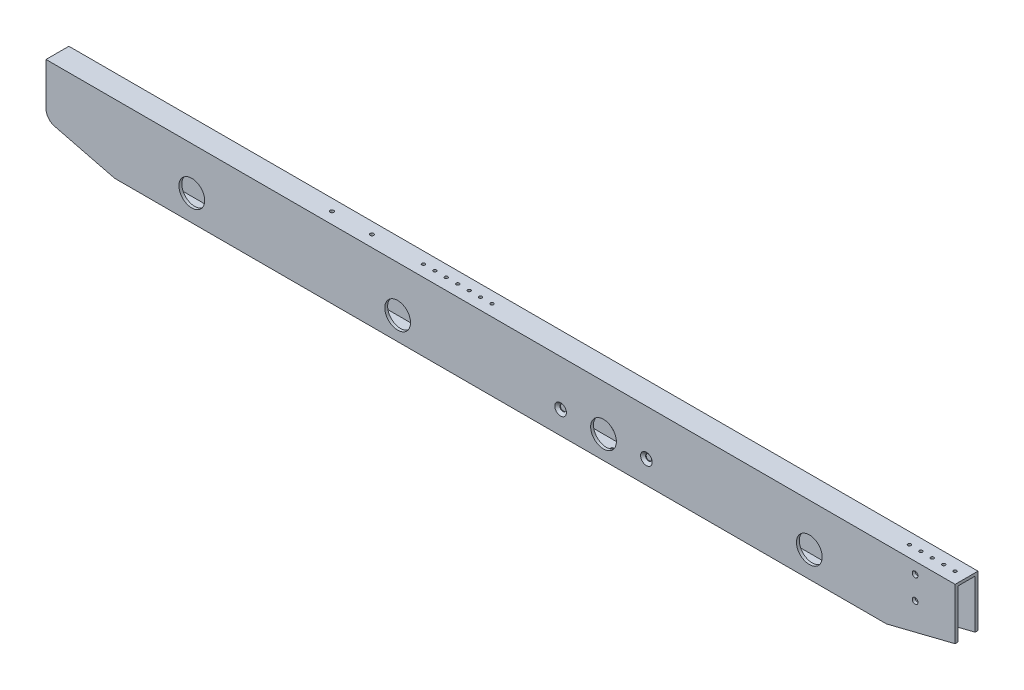
from build123d import *

# Parameters (mm, degrees)
SKETCH1_W                                           = 1009.65
SKETCH1_H                                           = 76.2
SKETCH1_R                                           = 14.2875
BOSS_EXTRUDE2_DEPTH                                 = 12.7
SKETCH3_W                                           = 19.05
SKETCH3_H                                           = 69.85
CUT_EXTRUDE2_DEPTH                                  = 1011.448426442
CUT_EXTRUDE3_DEPTH                                  = 507.897475457
FILLET1_R                                           = 12.7
SKETCH9_R                                           = 1.7272
CUT_EXTRUDE4_DEPTH                                  = 2.54
SKETCH12_R                                          = 1.7272
CUT_EXTRUDE7_DEPTH                                  = 5.08
CSK_FOR_1_4_FLAT_HEAD_MACHINE_SCREW_100_D           = 6.7564
CSK_FOR_1_4_FLAT_HEAD_MACHINE_SCREW_100_CSINK_D     = 12.8778
CSK_FOR_1_4_FLAT_HEAD_MACHINE_SCREW_100_CSINK_ANGLE = 100
CUT_EXTRUDE8_START                                  = -6.35
SKETCH17_R                                          = 1.7272
CUT_EXTRUDE8_DEPTH                                  = 6.35
SKETCH18_R                                          = 17.4625
CUT_EXTRUDE9_DEPTH                                  = 3.81
F_1_4_0_25_DIAMETER_HOLE1_D                         = 6.35
F_10_32_TAPPED_HOLE1_D                              = 4.0386
F_10_32_TAPPED_HOLE1_DEPTH                          = 13.716
F_10_32_TAPPED_HOLE1_TIP                            = 1.213317848


with BuildPart() as part:
    # Sketch1 → Boss-Extrude2 (new, symmetric)
    with BuildSketch(Plane.XY):
        Rectangle(SKETCH1_W, SKETCH1_H)
        with Locations((-114.3, -12.7)):
            Circle(SKETCH1_R, mode=Mode.SUBTRACT)
        with Locations((114.3, -12.7)):
            Circle(SKETCH1_R, mode=Mode.SUBTRACT)
        with Locations((-342.9, -9.525)):
            Circle(SKETCH1_R, mode=Mode.SUBTRACT)
        with Locations((342.9, -9.525)):
            Circle(SKETCH1_R, mode=Mode.SUBTRACT)
    extrude(amount=BOSS_EXTRUDE2_DEPTH, both=True)

    # Sketch3 → Cut-Extrude2 (cut, through all)
    with BuildSketch(Plane(origin=(504.825, 0, 0), x_dir=(0, 0, -1), z_dir=(1, 0, 0))):
        Rectangle(SKETCH3_W, SKETCH3_H)
    extrude(amount=-CUT_EXTRUDE2_DEPTH, mode=Mode.SUBTRACT)

    # Sketch4 → Cut-Extrude3 (cut, through all)
    with BuildSketch(Plane.XY.offset(12.7)):
        Polygon((-504.825, -38.1), (-504.825, -19.05), (-428.625, -38.1), align=None)
        Polygon((428.625, -38.1), (504.825, -38.1), (504.825, -19.05), align=None)
    extrude(amount=-CUT_EXTRUDE3_DEPTH, mode=Mode.SUBTRACT)

    # Fillet1
    fillet1_edges = [part.edges().sort_by_distance(p)[0] for p in [
        (-504.825, -19.05, 11.1125),
        (-504.825, -19.05, -11.1125),
    ]]
    fillet(fillet1_edges, radius=FILLET1_R)

    # Sketch9 → Cut-Extrude4 (cut)
    with BuildSketch(Plane(origin=(0, 38.1, 0), x_dir=(1, 0, 0), z_dir=(0, 1, 0))):
        with Locations(Location((492.125, 0, 0), (0, 0, 270))):
            Circle(SKETCH9_R)
        with Locations(Location((479.425, 0, 0), (0, 0, 270))):
            Circle(SKETCH9_R)
        with Locations(Location((466.725, 0, 0), (0, 0, 270))):
            Circle(SKETCH9_R)
        with Locations(Location((454.025, 0, 0), (0, 0, 270))):
            Circle(SKETCH9_R)
        with Locations(Location((441.325, 0, 0), (0, 0, 270))):
            Circle(SKETCH9_R)
    extrude(amount=-CUT_EXTRUDE4_DEPTH, mode=Mode.SUBTRACT)

    # Sketch12 → Cut-Extrude7 (cut)
    with BuildSketch(Plane(origin=(0, 38.1, 0), x_dir=(1, 0, 0), z_dir=(0, 1, 0))):
        with Locations(Location((-98.425, 0, 0), (0, 0, 270))):
            Circle(SKETCH12_R)
        with Locations(Location((-85.725, 0, 0), (0, 0, 270))):
            Circle(SKETCH12_R)
        with Locations(Location((-73.025, 0, 0), (0, 0, 270))):
            Circle(SKETCH12_R)
        with Locations(Location((-60.325, 0, 0), (0, 0, 270))):
            Circle(SKETCH12_R)
        with Locations(Location((-47.625, 0, 0), (0, 0, 270))):
            Circle(SKETCH12_R)
        with Locations(Location((-34.925, 0, 0), (0, 0, 270))):
            Circle(SKETCH12_R)
        with Locations(Location((-22.225, 0, 0), (0, 0, 270))):
            Circle(SKETCH12_R)
    extrude(amount=-CUT_EXTRUDE7_DEPTH, mode=Mode.SUBTRACT)

    # CSK for 1/4 Flat Head Machine Screw (100)2 (through all)
    with Locations(Plane.XY.offset(12.7)):
        with Locations((66.675, -12.7), (161.925, -12.7)):
            CounterSinkHole(CSK_FOR_1_4_FLAT_HEAD_MACHINE_SCREW_100_D / 2, CSK_FOR_1_4_FLAT_HEAD_MACHINE_SCREW_100_CSINK_D / 2, counter_sink_angle=CSK_FOR_1_4_FLAT_HEAD_MACHINE_SCREW_100_CSINK_ANGLE)

    # Sketch17 → Cut-Extrude8 (cut)
    with BuildSketch(Plane(origin=(0, -38.1, 0), x_dir=(-1, 0, 0), z_dir=(0, -1, 0)).offset(CUT_EXTRUDE8_START)):
        with Locations(Location((-415.925, 0, 0), (0, 0, 90))):
            Circle(SKETCH17_R)
        with Locations(Location((-396.875, 0, 0), (0, 0, 90))):
            Circle(SKETCH17_R)
        with Locations(Location((-377.825, 0, 0), (0, 0, 90))):
            Circle(SKETCH17_R)
        with Locations(Location((-358.775, 0, 0), (0, 0, 90))):
            Circle(SKETCH17_R)
        with Locations(Location((-339.725, 0, 0), (0, 0, 90))):
            Circle(SKETCH17_R)
        with Locations(Location((-320.675, 0, 0), (0, 0, 90))):
            Circle(SKETCH17_R)
        with Locations(Location((-301.625, 0, 0), (0, 0, 90))):
            Circle(SKETCH17_R)
        with Locations(Location((-282.575, 0, 0), (0, 0, 90))):
            Circle(SKETCH17_R)
        with Locations(Location((-263.525, 0, 0), (0, 0, 90))):
            Circle(SKETCH17_R)
        with Locations(Location((-244.475, 0, 0), (0, 0, 90))):
            Circle(SKETCH17_R)
        with Locations(Location((-225.425, 0, 0), (0, 0, 90))):
            Circle(SKETCH17_R)
        with Locations(Location((-206.375, 0, 0), (0, 0, 90))):
            Circle(SKETCH17_R)
        with Locations(Location((-187.325, 0, 0), (0, 0, 90))):
            Circle(SKETCH17_R)
        with Locations(Location((-168.275, 0, 0), (0, 0, 90))):
            Circle(SKETCH17_R)
        with Locations(Location((-149.225, 0, 0), (0, 0, 90))):
            Circle(SKETCH17_R)
        with Locations(Location((-130.175, 0, 0), (0, 0, 90))):
            Circle(SKETCH17_R)
        with Locations(Location((-111.125, 0, 0), (0, 0, 90))):
            Circle(SKETCH17_R)
        with Locations(Location((-92.075, 0, 0), (0, 0, 90))):
            Circle(SKETCH17_R)
        with Locations(Location((-73.025, 0, 0), (0, 0, 90))):
            Circle(SKETCH17_R)
        with Locations(Location((-53.975, 0, 0), (0, 0, 90))):
            Circle(SKETCH17_R)
        with Locations(Location((-34.925, 0, 0), (0, 0, 90))):
            Circle(SKETCH17_R)
        with Locations(Location((-15.875, 0, 0), (0, 0, 90))):
            Circle(SKETCH17_R)
        with Locations(Location((3.175, 0, 0), (0, 0, 90))):
            Circle(SKETCH17_R)
        with Locations(Location((22.225, 0, 0), (0, 0, 270))):
            Circle(SKETCH17_R)
        with Locations(Location((41.275, 0, 0), (0, 0, 90))):
            Circle(SKETCH17_R)
        with Locations(Location((60.325, 0, 0), (0, 0, 270))):
            Circle(SKETCH17_R)
    extrude(amount=CUT_EXTRUDE8_DEPTH, mode=Mode.SUBTRACT)

    # Sketch18 → Cut-Extrude9 (cut)
    with BuildSketch(Plane(origin=(0, 0, -12.7), x_dir=(-1, 0, 0), z_dir=(0, 0, -1))):
        with Locations((-114.3, -12.7)):
            Circle(SKETCH18_R)
    extrude(amount=-CUT_EXTRUDE9_DEPTH, mode=Mode.SUBTRACT)

    # 1/4 (0.25) Diameter Hole1 (through all)
    with Locations(Plane.XY.offset(12.7)):
        with Locations((460.375, 25.4), (460.375, 0)):
            Hole(F_1_4_0_25_DIAMETER_HOLE1_D / 2)

    # #10-32 Tapped Hole1
    with Locations(Plane(origin=(0, 38.1, 0), x_dir=(1, 0, 0), z_dir=(0, 1, 0))):
        with Locations((-155.575, 0), (-200.025, 0)):
            Hole(F_10_32_TAPPED_HOLE1_D / 2, depth=F_10_32_TAPPED_HOLE1_DEPTH)
            with Locations((0, 0, -(F_10_32_TAPPED_HOLE1_DEPTH + F_10_32_TAPPED_HOLE1_TIP / 2))):  # 118° drill point
                Cone(0, F_10_32_TAPPED_HOLE1_D / 2, F_10_32_TAPPED_HOLE1_TIP, mode=Mode.SUBTRACT)


solid = part.part
